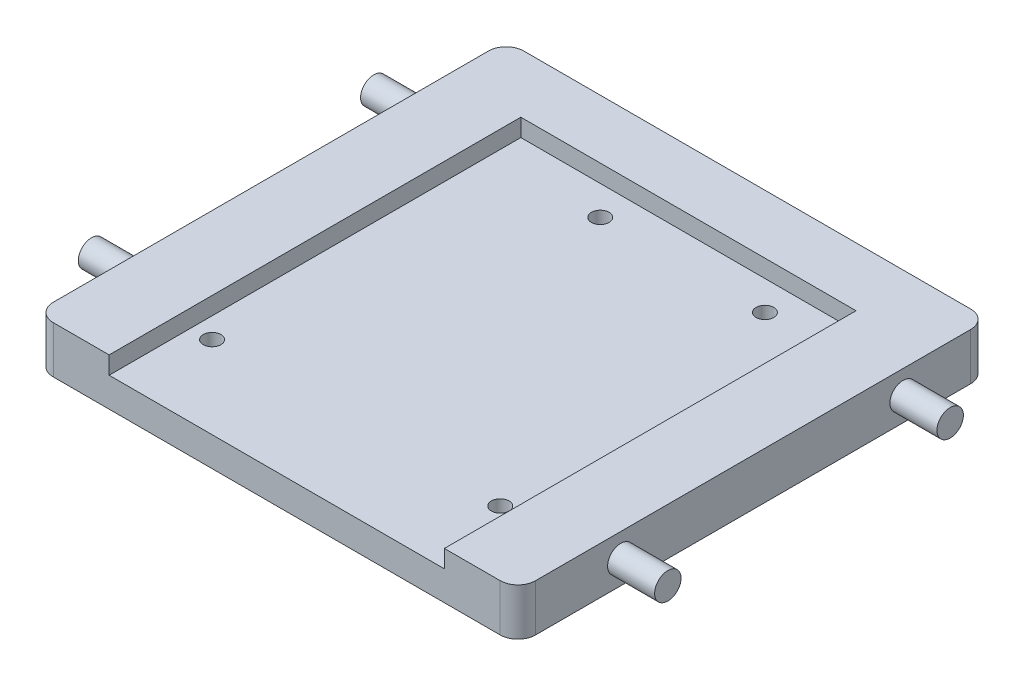
from build123d import *

# Parameters (mm, degrees)
SKETCH1_W                = 82
SKETCH1_H                = 80
BOSS_EXTRUDE1_DEPTH      = 8
BOSS_EXTRUDE2_DEPTH      = 8
BOSS_EXTRUDE2_DEPTH_BACK = 90
SKETCH2_R                = 2.25
SKETCH3_W                = 57
SKETCH3_H                = 70
CUT_EXTRUDE1_DEPTH       = 3
SKETCH4_R                = 1.5
CUT_EXTRUDE2_DEPTH       = 3
FILLET1_R                = 3


with BuildPart() as part:
    # Sketch1 → Boss-Extrude1 (new body)
    with BuildSketch(Plane(origin=(0, 0, 0), x_dir=(1, 0, 0), z_dir=(0, 1, 0))):
        with Locations((0, 40)):
            Rectangle(SKETCH1_W, SKETCH1_H)
    extrude(amount=BOSS_EXTRUDE1_DEPTH)

    # Sketch2 → Boss-Extrude2 (add, two sides: drawn at the far end of the back side and taken through both)
    with BuildSketch(Plane(origin=(41, 0, 0), x_dir=(0, 0, -1), z_dir=(1, 0, 0)).offset(-BOSS_EXTRUDE2_DEPTH_BACK)):
        with Locations((17.5, 4)):
            Circle(SKETCH2_R)
        with Locations((65.5, 4)):
            Circle(SKETCH2_R)
    extrude(amount=BOSS_EXTRUDE2_DEPTH + BOSS_EXTRUDE2_DEPTH_BACK)

    # Sketch3 → Cut-Extrude1 (cut)
    with BuildSketch(Plane(origin=(0, 8, 0), x_dir=(1, 0, 0), z_dir=(0, 1, 0))):
        with Locations((0, 35)):
            Rectangle(SKETCH3_W, SKETCH3_H)
    extrude(amount=-CUT_EXTRUDE1_DEPTH, mode=Mode.SUBTRACT)

    # Sketch4 → Cut-Extrude2 (cut)
    with BuildSketch(Plane(origin=(0, 5, 0), x_dir=(1, 0, 0), z_dir=(0, 1, 0))):
        with Locations(Location((-25, 14, 0), (0, 0, 270))):
            Circle(SKETCH4_R)
        with Locations(Location((-10, 65, 0), (0, 0, 270))):
            Circle(SKETCH4_R)
        with Locations(Location((18, 65, 0), (0, 0, 270))):
            Circle(SKETCH4_R)
        with Locations(Location((24, 14, 0), (0, 0, 270))):
            Circle(SKETCH4_R)
    extrude(amount=-CUT_EXTRUDE2_DEPTH, mode=Mode.SUBTRACT)

    # Fillet1
    fillet1_edges = [part.edges().sort_by_distance(p)[0] for p in [
        (-41, 4, -80),
        (41, 4, -80),
        (41, 4, 0),
        (-41, 4, 0),
    ]]
    fillet(fillet1_edges, radius=FILLET1_R)


solid = part.part
